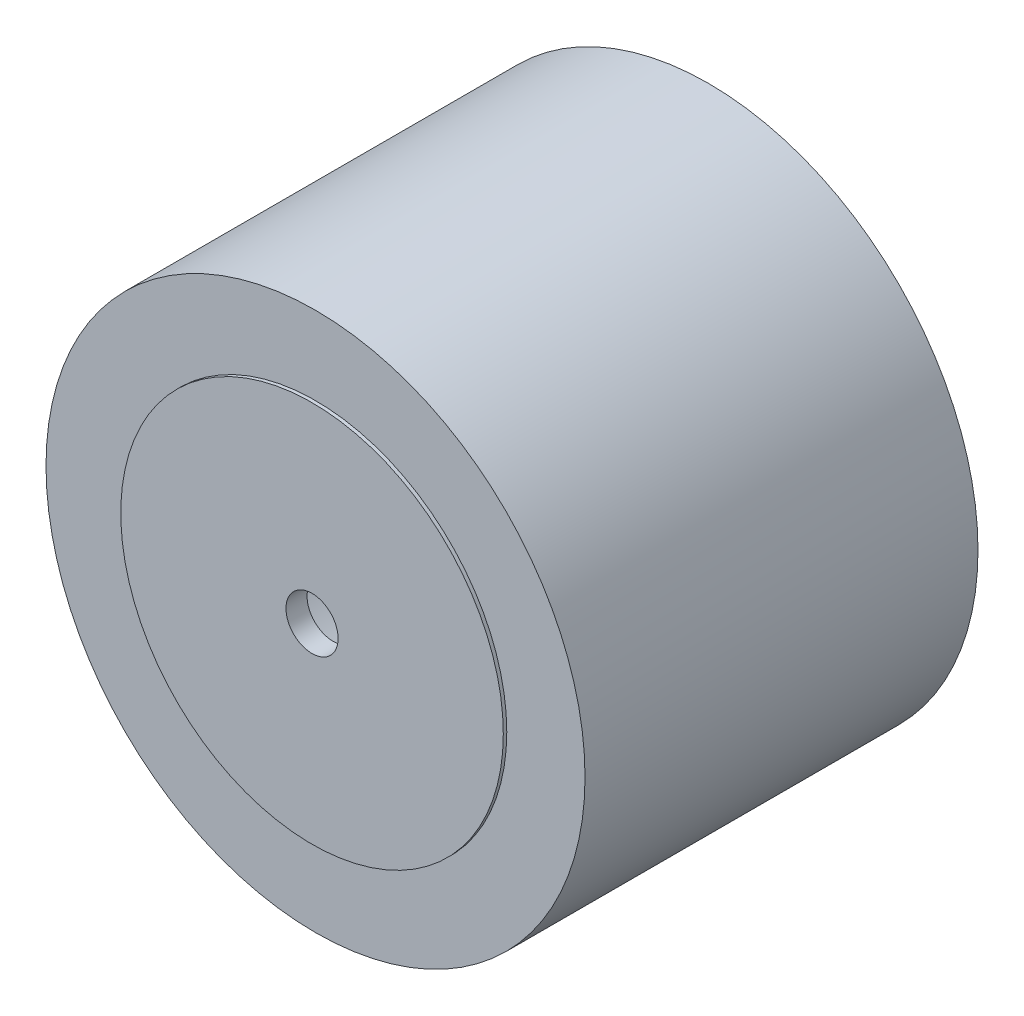
from build123d import *


with BuildPart() as part:
    # Croquis1 → Revolución1 (revolve)
    with BuildSketch(Plane(origin=(0, 0, 0), x_dir=(1, 0, 0), z_dir=(0, 1, 0))):
        Polygon((1.5, 1.013513514), (8.5, 1.013513514), (8.5, 22.8), (11, 22.8), (11, 22.6), (15.5, 22.6), (15.5, 0), (11, 0), (11, -0.2), (1.5, -0.2), align=None)
    revolve(axis=Axis((0, 0, 0), (0, 0, -1)))


solid = part.part
